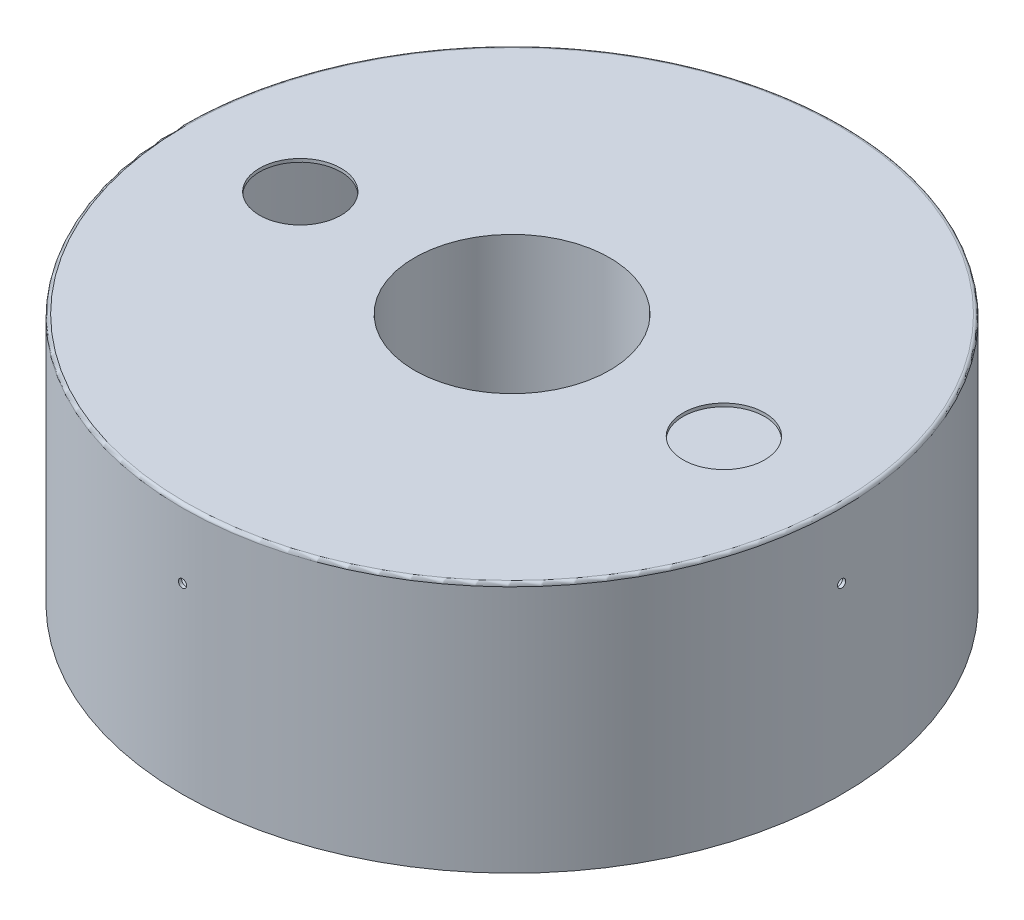
from build123d import *

# Parameters (mm, degrees)
SKETCH9_R               = 2000
BOSS_EXTRUDE5_DEPTH     = 1500
SKETCH10_R              = 598.217
CUT_EXTRUDE3_DEPTH      = 1500
SHELL6_T                = 20
SKETCH11_R              = 598.217
BOSS_EXTRUDE6_DEPTH     = 1540
BOSS_EXTRUDE7_REACH     = 3247.366
SKETCH13_R              = 618.217
SKETCH14_R              = 598.217
CUT_EXTRUDE5_DEPTH      = 3246.36592698
FILLET2_R               = 20
CUT_EXTRUDE6_DEPTH      = 3246.365927042
CUT_EXTRUDE6_DEPTH_BACK = 547
SKETCH16_R              = 250
CUT_EXTRUDE11_START     = 1700
SKETCH19_R              = 24.963
CUT_EXTRUDE11_DEPTH     = 400
CIRPATTERN1_COUNT       = 4


with BuildPart() as part:
    # Sketch9 → Boss-Extrude5 (new body)
    with BuildSketch(Plane(origin=(0, 0, 0), x_dir=(1, 0, 0), z_dir=(0, 1, 0))):
        with Locations(Location((0, 0, 0), (0, 0, 270))):
            Circle(SKETCH9_R)
    extrude(amount=BOSS_EXTRUDE5_DEPTH)

    # Sketch10 → Cut-Extrude3 (cut)
    with BuildSketch(Plane(origin=(0, 1500, 0), x_dir=(1, 0, 0), z_dir=(0, 1, 0))):
        with Locations(Location((0, 0, 0), (0, 0, 270))):
            Circle(SKETCH10_R)
    extrude(amount=-CUT_EXTRUDE3_DEPTH, mode=Mode.SUBTRACT)

    # Shell6
    shell6_openings = [part.faces().sort_by_distance(p)[0] for p in [
        (0, 750, -598.217),
    ]]
    offset(amount=SHELL6_T, openings=shell6_openings, kind=Kind.INTERSECTION)

    # Sketch11 → Boss-Extrude6 (add, through all)
    with BuildSketch(Plane(origin=(0, 1520, 0), x_dir=(1, 0, 0), z_dir=(0, 1, 0))):
        with Locations(Location((0, 0, 0), (0, 0, 270))):
            Circle(SKETCH11_R)
    extrude(amount=-BOSS_EXTRUDE6_DEPTH)

    # Sketch13 → Boss-Extrude7 (add, up to next)
    with BuildSketch(Plane(origin=(0, 1520, 0), x_dir=(1, 0, 0), z_dir=(0, 1, 0)), mode=Mode.PRIVATE) as boss_extrude7_sk1:
        with Locations(Location((0, 0, 0), (0, 0, 270))):
            Circle(SKETCH13_R)
    boss_extrude7_tool1 = extrude(boss_extrude7_sk1.sketch, amount=-BOSS_EXTRUDE7_REACH, mode=Mode.PRIVATE) - part.part
    add(boss_extrude7_tool1.solids().sort_by_distance((0, 1520, 0))[0])

    # Sketch14 → Cut-Extrude5 (cut, through all)
    with BuildSketch(Plane(origin=(0, 1520, 0), x_dir=(1, 0, 0), z_dir=(0, 1, 0))):
        with Locations(Location((0, 0, 0), (0, 0, 270))):
            Circle(SKETCH14_R)
    extrude(amount=-CUT_EXTRUDE5_DEPTH, mode=Mode.SUBTRACT)

    # Fillet2
    fillet2_edges = [part.edges().sort_by_distance(p)[0] for p in [
        (0, 1520, -2020),
    ]]
    fillet(fillet2_edges, radius=FILLET2_R)

    # Sketch16 → Cut-Extrude6 (cut, two sides: drawn at the far end of the back side and taken through both)
    with BuildSketch(Plane(origin=(0, 1520, 0), x_dir=(1, 0, 0), z_dir=(0, 1, 0)).offset(-CUT_EXTRUDE6_DEPTH_BACK)):
        with Locations(Location((-1298.217, 0, 0), (0, 0, 90))):
            Circle(SKETCH16_R)
        with Locations(Location((1298.217, 0, 0), (0, 0, 90))):
            Circle(SKETCH16_R)
    extrude(amount=CUT_EXTRUDE6_DEPTH + CUT_EXTRUDE6_DEPTH_BACK, mode=Mode.SUBTRACT)

    # Sketch19 → Cut-Extrude11 (cut)
    with BuildSketch(Plane.XY.offset(CUT_EXTRUDE11_START)):
        with Locations((0, 1100)):
            Circle(SKETCH19_R)
    cut_extrude11 = extrude(amount=CUT_EXTRUDE11_DEPTH, mode=Mode.SUBTRACT)

    # CirPattern1: Cut-Extrude11 ×4 about axis
    cirpattern1_axis = Axis((0, 1520, 0), (0, 1, 0))
    for i in range(1, CIRPATTERN1_COUNT):
        add(cut_extrude11.rotate(cirpattern1_axis, i * 360 / CIRPATTERN1_COUNT), mode=Mode.SUBTRACT)


solid = part.part
